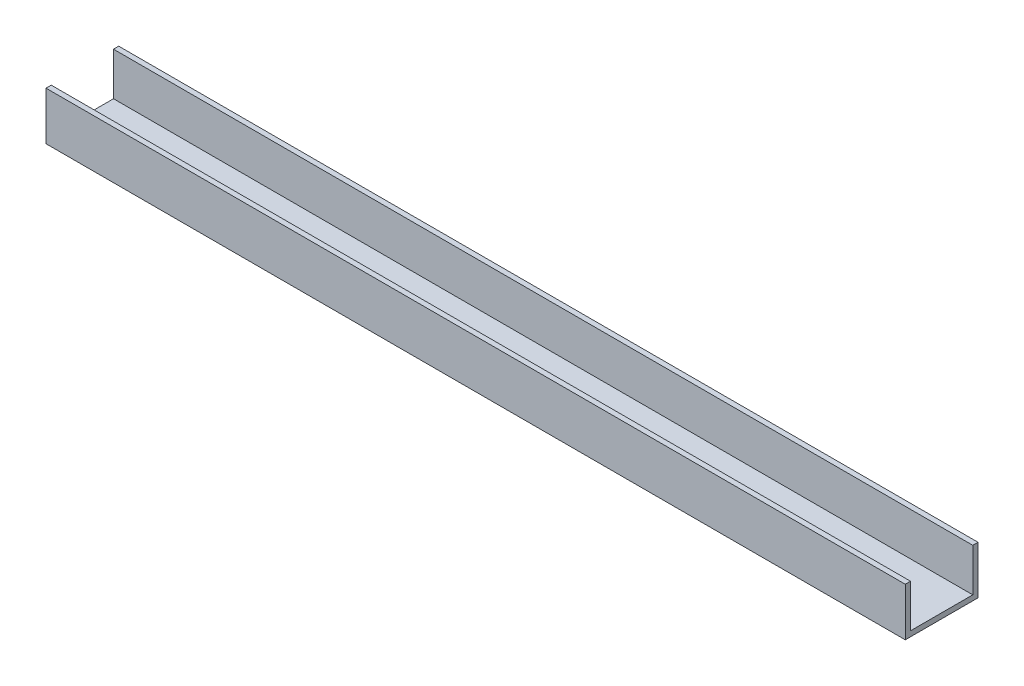
from build123d import *

# Parameters (mm, degrees)
BOSS_EXTRUDE1_DEPTH = 262.89


with BuildPart() as part:
    # Sketch1 → Boss-Extrude1 (new body)
    with BuildSketch(Plane(origin=(0, 0, 0), x_dir=(0, 0, -1), z_dir=(1, 0, 0))):
        Polygon((9.525, 1.6002), (-9.525, 1.6002), (-9.525, 14.732), (-11.1252, 14.732), (-11.1252, 0), (11.1252, 0), (11.1252, 14.732), (9.525, 14.732), align=None)
    extrude(amount=BOSS_EXTRUDE1_DEPTH)


solid = part.part
